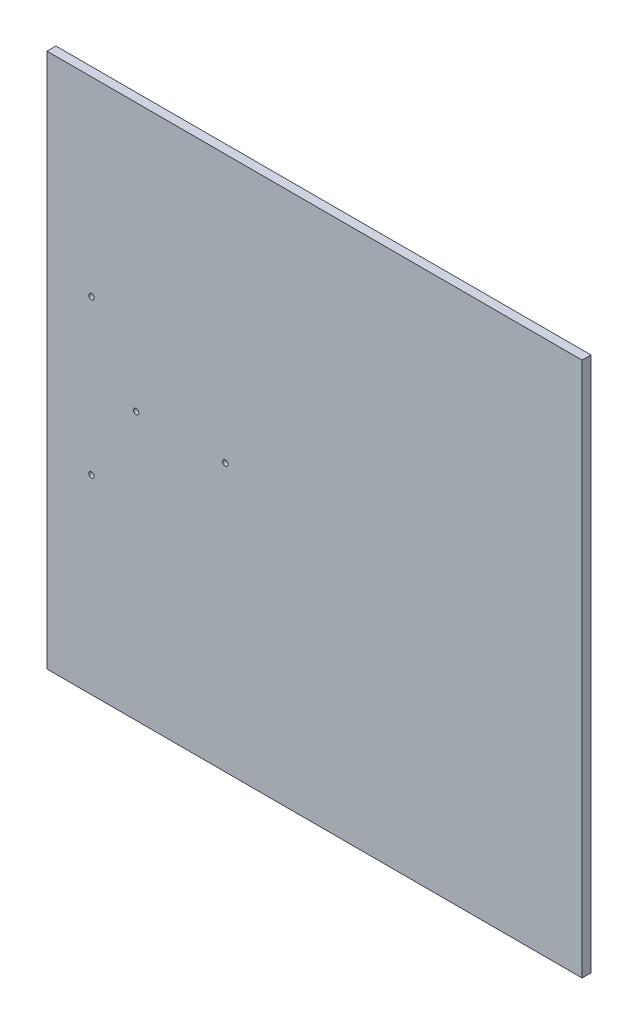
from build123d import *

# Parameters (mm, degrees)
SKETCH1_W           = 300
SKETCH1_H           = 300
BOSS_EXTRUDE1_DEPTH = 5
SKETCH5_R           = 1.5
CUT_EXTRUDE3_DEPTH  = 278.997367795
SKETCH6_R           = 1.5
CUT_EXTRUDE5_DEPTH  = 278.997367795


with BuildPart() as part:
    # Sketch1 → Boss-Extrude1 (new body)
    with BuildSketch(Plane.XY):
        with Locations((0.887573964, -83.431952663)):
            Rectangle(SKETCH1_W, SKETCH1_H)
    extrude(amount=BOSS_EXTRUDE1_DEPTH)

    # Sketch5 → Cut-Extrude3 (cut, through all)
    with BuildSketch(Plane.XY.offset(5)):
        with Locations((-99.112426036, -83.431952663)):
            Circle(SKETCH5_R)
    extrude(amount=-CUT_EXTRUDE3_DEPTH, mode=Mode.SUBTRACT)

    # Sketch6 → Cut-Extrude5 (cut, through all)
    with BuildSketch(Plane.XY.offset(5)):
        with Locations((-49.112426036, -83.431952663)):
            Circle(SKETCH6_R)
        with Locations((-124.112426036, -40.130682474)):
            Circle(SKETCH6_R)
        with Locations(Location((-124.112426036, -126.733222852, 0), (0, 0, 180))):
            Circle(SKETCH6_R)
    extrude(amount=-CUT_EXTRUDE5_DEPTH, mode=Mode.SUBTRACT)


solid = part.part
